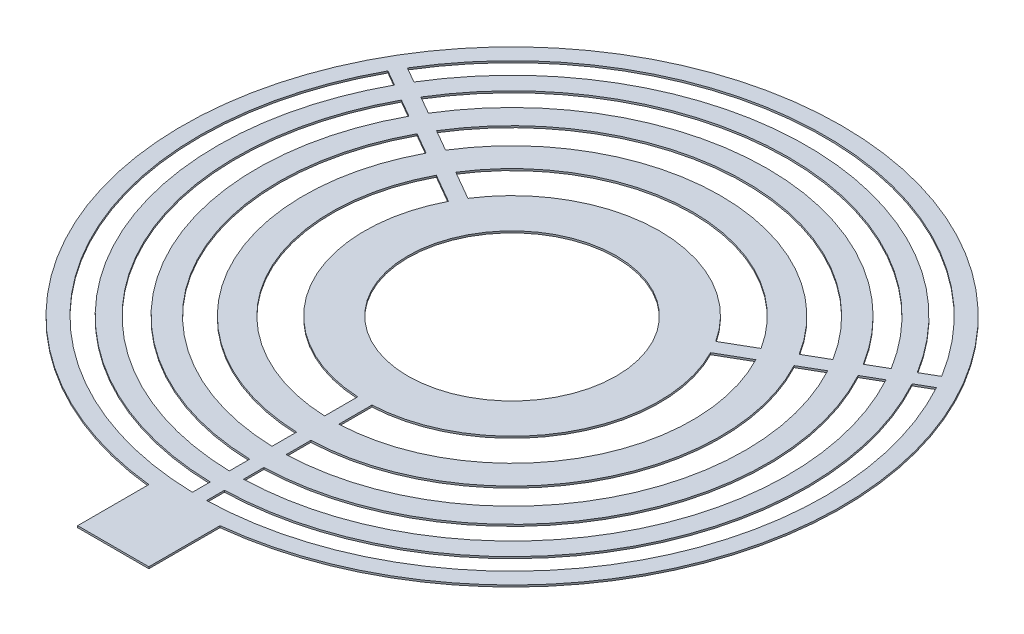
from build123d import *

# Parameters (mm, degrees)
SKETCH_1_R      = 29.29
EXTRUDE_1_DEPTH = 0.5


with BuildPart() as part:
    # 草图1 → 凸台-拉伸1 (new body)
    with BuildSketch(Plane(origin=(0, 0, 0), x_dir=(1, 0, 0), z_dir=(0, 1, 0))):
        with BuildLine():
            Line((-10, -92.088636107), (-10, -112.088636107))
            Line((-10, -112.088636107), (10, -112.088636107))
            Line((10, -112.088636107), (10, -92.088636107))
            ThreePointArc((10, -92.088636107), (0, 92.63), (-10, -92.088636107))
        make_face()
        with Locations(Location((0, 0, 0), (0, 0, 270))):
            Circle(SKETCH_1_R, mode=Mode.SUBTRACT)
        with BuildLine():
            Line((-2, -41.37168597), (-2, -50.690560265))
            ThreePointArc((-2, -50.690560265), (-43.933468734, -25.365), (-44.899312922, 23.613229325))
            Line((-44.899312922, 23.613229325), (-36.828931047, 18.953792177))
            ThreePointArc((-36.828931047, 18.953792177), (-35.870772225, -20.71), (-2, -41.37168597))
        make_face(mode=Mode.SUBTRACT)
        with BuildLine():
            Line((2, -41.37168597), (2, -50.690560265))
            ThreePointArc((2, -50.690560265), (43.933468734, -25.365), (44.899312922, 23.613229325))
            Line((44.899312922, 23.613229325), (36.828931047, 18.953792177))
            ThreePointArc((36.828931047, 18.953792177), (35.870772225, -20.71), (2, -41.37168597))
        make_face(mode=Mode.SUBTRACT)
        with BuildLine():
            Line((-34.828931047, 22.417893793), (-42.899312922, 27.07733094))
            ThreePointArc((-42.899312922, 27.07733094), (0, 50.73), (42.899312922, 27.07733094))
            Line((42.899312922, 27.07733094), (34.828931047, 22.417893793))
            ThreePointArc((34.828931047, 22.417893793), (0, 41.42), (-34.828931047, 22.417893793))
        make_face(mode=Mode.SUBTRACT)
        with BuildLine():
            Line((51.70219226, 27.540873542), (57.698214258, 31.002678457))
            ThreePointArc((57.698214258, 31.002678457), (56.724663948, -32.75), (2, -65.469458528))
            Line((2, -65.469458528), (2, -58.5458487))
            ThreePointArc((2, -58.5458487), (50.731768154, -29.29), (51.70219226, 27.540873542))
        make_face(mode=Mode.SUBTRACT)
        with BuildLine():
            Line((49.70219226, 31.004975158), (55.698214258, 34.466780072))
            ThreePointArc((55.698214258, 34.466780072), (0, 65.5), (-55.698214258, 34.466780072))
            Line((-55.698214258, 34.466780072), (-49.70219226, 31.004975158))
            ThreePointArc((-49.70219226, 31.004975158), (0, 58.58), (49.70219226, 31.004975158))
        make_face(mode=Mode.SUBTRACT)
        with BuildLine():
            Line((63.11317795, 34.129009202), (68.094616028, 37.005043818))
            ThreePointArc((68.094616028, 37.005043818), (67.116968793, -38.75), (2, -77.47418925))
            Line((2, -77.47418925), (2, -71.722120019))
            ThreePointArc((2, -71.722120019), (62.137322722, -35.875), (63.11317795, 34.129009202))
        make_face(mode=Mode.SUBTRACT)
        with BuildLine():
            Line((61.11317795, 37.593110817), (66.094616028, 40.469145433))
            ThreePointArc((66.094616028, 40.469145433), (0, 77.5), (-66.094616028, 40.469145433))
            Line((-66.094616028, 40.469145433), (-61.11317795, 37.593110817))
            ThreePointArc((-61.11317795, 37.593110817), (0, 71.75), (61.11317795, 37.593110817))
        make_face(mode=Mode.SUBTRACT)
        with BuildLine():
            Line((72.729295793, 39.680877427), (77.077938162, 42.19156727))
            ThreePointArc((77.077938162, 42.19156727), (76.097652231, -43.935), (2, -87.847236155))
            Line((2, -87.847236155), (2, -82.82585647))
            ThreePointArc((2, -82.82585647), (71.750204704, -41.425), (72.729295793, 39.680877427))
        make_face(mode=Mode.SUBTRACT)
        with BuildLine():
            Line((70.729295793, 43.144979043), (75.077938162, 45.655668885))
            ThreePointArc((75.077938162, 45.655668885), (0, 87.87), (-75.077938162, 45.655668885))
            Line((-75.077938162, 45.655668885), (-70.729295793, 43.144979043))
            ThreePointArc((-70.729295793, 43.144979043), (0, 82.85), (70.729295793, 43.144979043))
        make_face(mode=Mode.SUBTRACT)
        with BuildLine():
            Line((-51.70219226, 27.540873542), (-57.698214258, 31.002678457))
            ThreePointArc((-57.698214258, 31.002678457), (-56.724663948, -32.75), (-2, -65.469458528))
            Line((-2, -65.469458528), (-2, -58.5458487))
            ThreePointArc((-2, -58.5458487), (-50.731768154, -29.29), (-51.70219226, 27.540873542))
        make_face(mode=Mode.SUBTRACT)
        with BuildLine():
            Line((-63.11317795, 34.129009202), (-68.094616028, 37.005043818))
            ThreePointArc((-68.094616028, 37.005043818), (-67.116968793, -38.75), (-2, -77.47418925))
            Line((-2, -77.47418925), (-2, -71.722120019))
            ThreePointArc((-2, -71.722120019), (-62.137322722, -35.875), (-63.11317795, 34.129009202))
        make_face(mode=Mode.SUBTRACT)
        with BuildLine():
            Line((-72.729295793, 39.680877427), (-77.077938162, 42.19156727))
            ThreePointArc((-77.077938162, 42.19156727), (-76.097652231, -43.935), (-2, -87.847236155))
            Line((-2, -87.847236155), (-2, -82.82585647))
            ThreePointArc((-2, -82.82585647), (-71.750204704, -41.425), (-72.729295793, 39.680877427))
        make_face(mode=Mode.SUBTRACT)
    extrude(amount=EXTRUDE_1_DEPTH)


solid = part.part
